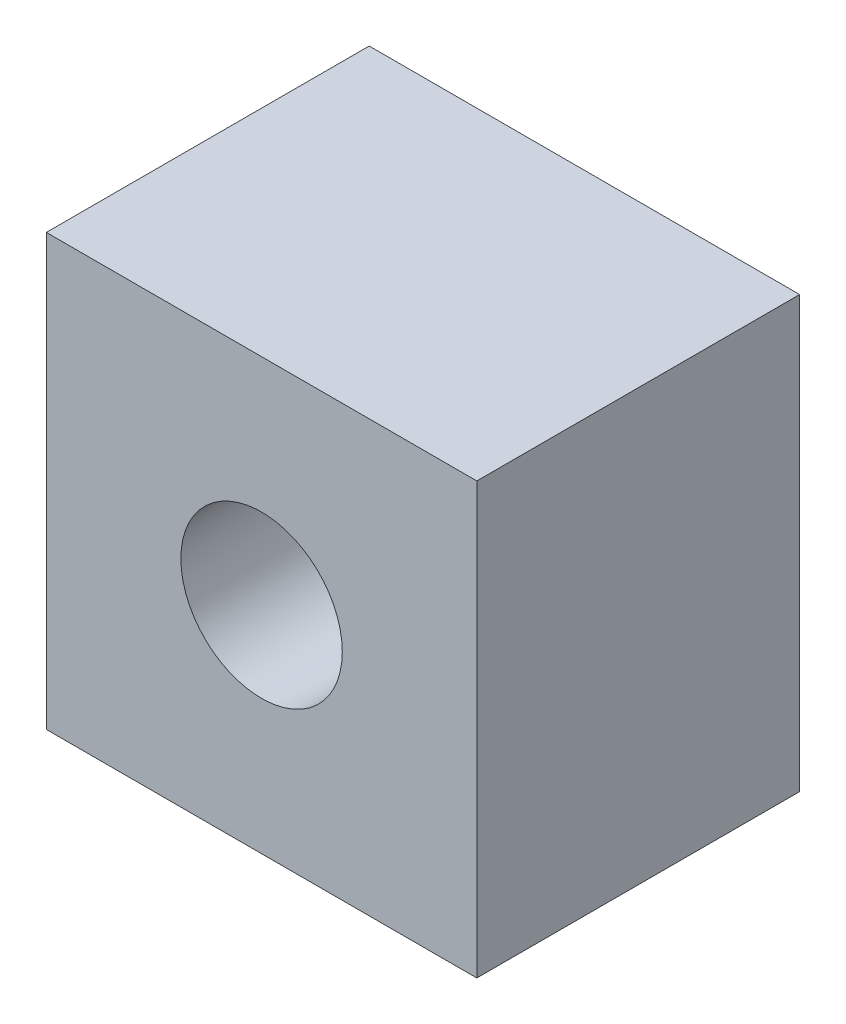
from build123d import *

# Parameters (mm, degrees)
ESQUISSE1_W        = 40
ESQUISSE1_H        = 40
BOSS_EXTRU_1_DEPTH = 30
D_GAGEMENT_M21_D   = 15


with BuildPart() as part:
    # Esquisse1 → Boss.-Extru.1 (new body)
    with BuildSketch(Plane.XY):
        with Locations((20, -20)):
            Rectangle(ESQUISSE1_W, ESQUISSE1_H)
    extrude(amount=BOSS_EXTRU_1_DEPTH)

    # Dégagement M21 (through all)
    with Locations(Plane(origin=(20, -20, 30), x_dir=(1, 0, 0), z_dir=(0, 0, 1))):
        with Locations((0, 0)):
            Hole(D_GAGEMENT_M21_D / 2)


solid = part.part
